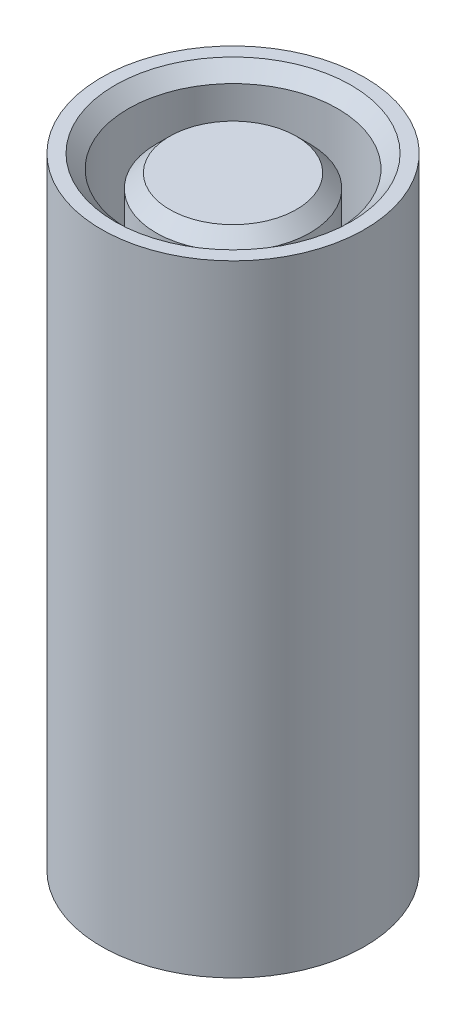
from build123d import *

# Parameters (mm, degrees)
CHANFREIN1_SIZE = 0.4
CHANFREIN2_SIZE = 0.4


with BuildPart() as part:
    # Esquisse1 → Base-Révolution (revolve)
    with BuildSketch(Plane.XY, mode=Mode.PRIVATE) as base_r_volution_sk:
        with BuildLine():
            Line((-3.1, 0), (-3.9, 0))
            Line((-3.9, 0), (-3.9, 18.4))
            Line((-3.9, 18.4), (-3.1, 18.4))
            Line((-3.1, 18.4), (-3.1, 17.6))
            Line((-3.1, 17.6), (-3.1, 15))
            Line((-3.1, 15), (-2.279338742, 15))
            Line((-2.279338742, 15), (-2.279338742, 17.9))
            Line((-2.279338742, 17.9), (0, 17.9))
            Line((0, 17.9), (0, 16.9))
            Line((0, 16.9), (-1.5, 16.9))
            Line((-1.5, 16.9), (-1.5, 10.098076211))
            ThreePointArc((-1.5, 10.098076211), (-2.956912699, 8.006623421), (-2.279338742, 5.549457793))
            Line((-2.279338742, 5.549457793), (-3.1, 3))
            Line((-3.1, 3), (-3.1, 0.8))
            Line((-3.1, 0.8), (-3.1, 0))
        make_face()
    revolve(base_r_volution_sk.sketch.rotate(Axis((0, 0, 0), (0, 1, 0)), 270), axis=Axis((0, 0, 0), (0, 1, 0)))

    # Chanfrein1
    chanfrein1_edges = [part.edges().sort_by_distance(p)[0] for p in [
        (0, 18.4, 3.1),
    ]]
    chamfer(chanfrein1_edges, length=CHANFREIN1_SIZE)

    # Chanfrein2
    chanfrein2_edges = [part.edges().sort_by_distance(p)[0] for p in [
        (0, 17.9, 2.279338742),
    ]]
    chamfer(chanfrein2_edges, length=CHANFREIN2_SIZE)


solid = part.part
